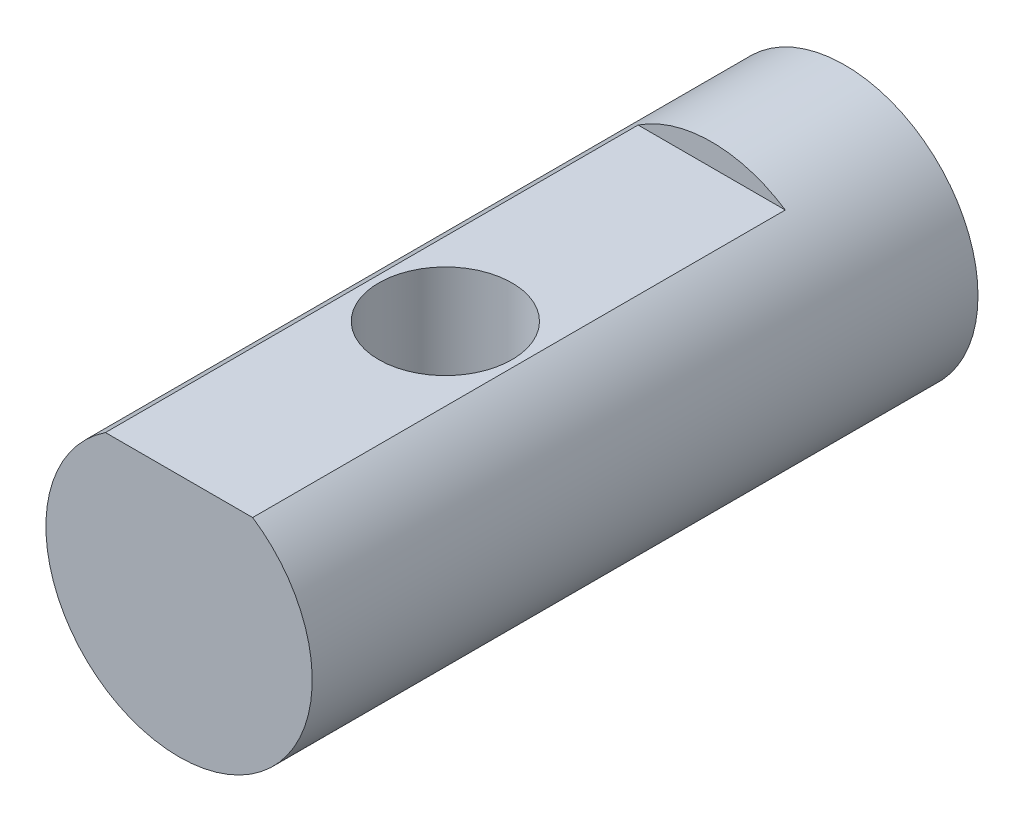
from build123d import *

# Parameters (mm, degrees)
SKETCH1_R           = 3
BOSS_EXTRUDE1_DEPTH = 15
CUT_EXTRUDE1_START  = -12
CUT_EXTRUDE1_DEPTH  = 12
SKETCH3_R           = 1.5
CUT_EXTRUDE2_DEPTH  = 6


with BuildPart() as part:
    # Sketch1 → Boss-Extrude1 (new body)
    with BuildSketch(Plane.XY):
        Circle(SKETCH1_R)
    extrude(amount=BOSS_EXTRUDE1_DEPTH)

    # Sketch2 → Cut-Extrude1 (cut)
    with BuildSketch(Plane.XY.offset(15).offset(CUT_EXTRUDE1_START)):
        with BuildLine():
            Line((-1.658312395, 2.5), (1.658312395, 2.5))
            ThreePointArc((1.658312395, 2.5), (0, 3), (-1.658312395, 2.5))
        make_face()
    extrude(amount=CUT_EXTRUDE1_DEPTH, mode=Mode.SUBTRACT)

    # Sketch3 → Cut-Extrude2 (cut)
    with BuildSketch(Plane(origin=(0, 2.5, 0), x_dir=(1, 0, 0), z_dir=(0, 1, 0))):
        with Locations(Location((0, -9, 0), (0, 0, 270))):
            Circle(SKETCH3_R)
    extrude(amount=-CUT_EXTRUDE2_DEPTH, mode=Mode.SUBTRACT)


solid = part.part
